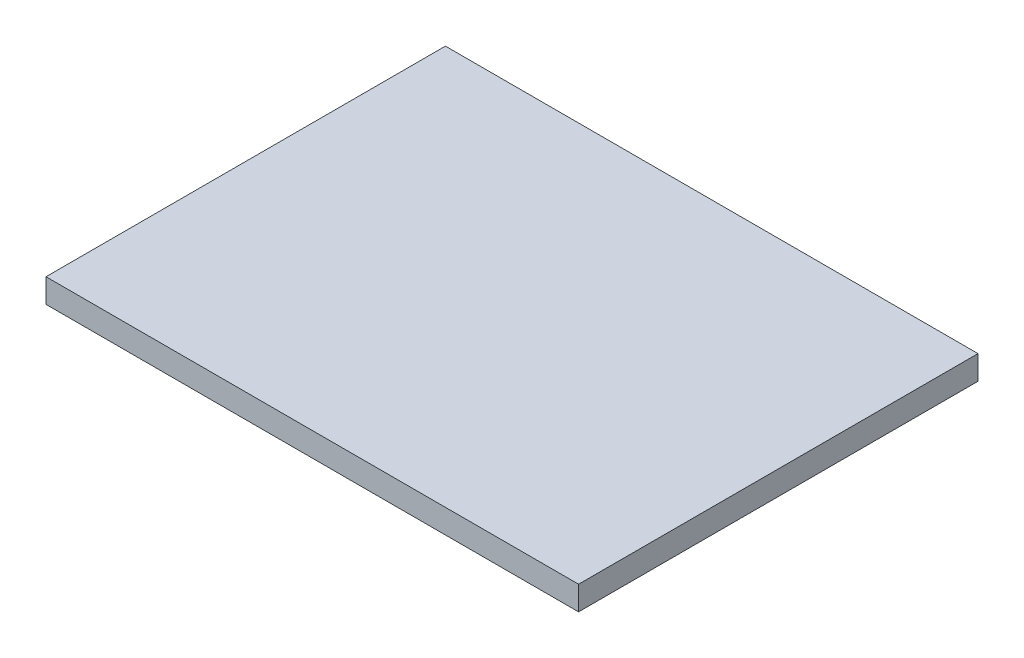
from build123d import *

# Parameters (mm, degrees)
SKETCH2_W           = 400
SKETCH2_H           = 300
BOSS_EXTRUDE1_DEPTH = 18


with BuildPart() as part:
    # Sketch2 → Boss-Extrude1 (new body)
    with BuildSketch(Plane(origin=(0, 0, 0), x_dir=(1, 0, 0), z_dir=(0, 1, 0))):
        with Locations((200, 150)):
            Rectangle(SKETCH2_W, SKETCH2_H)
    extrude(amount=BOSS_EXTRUDE1_DEPTH)


solid = part.part
